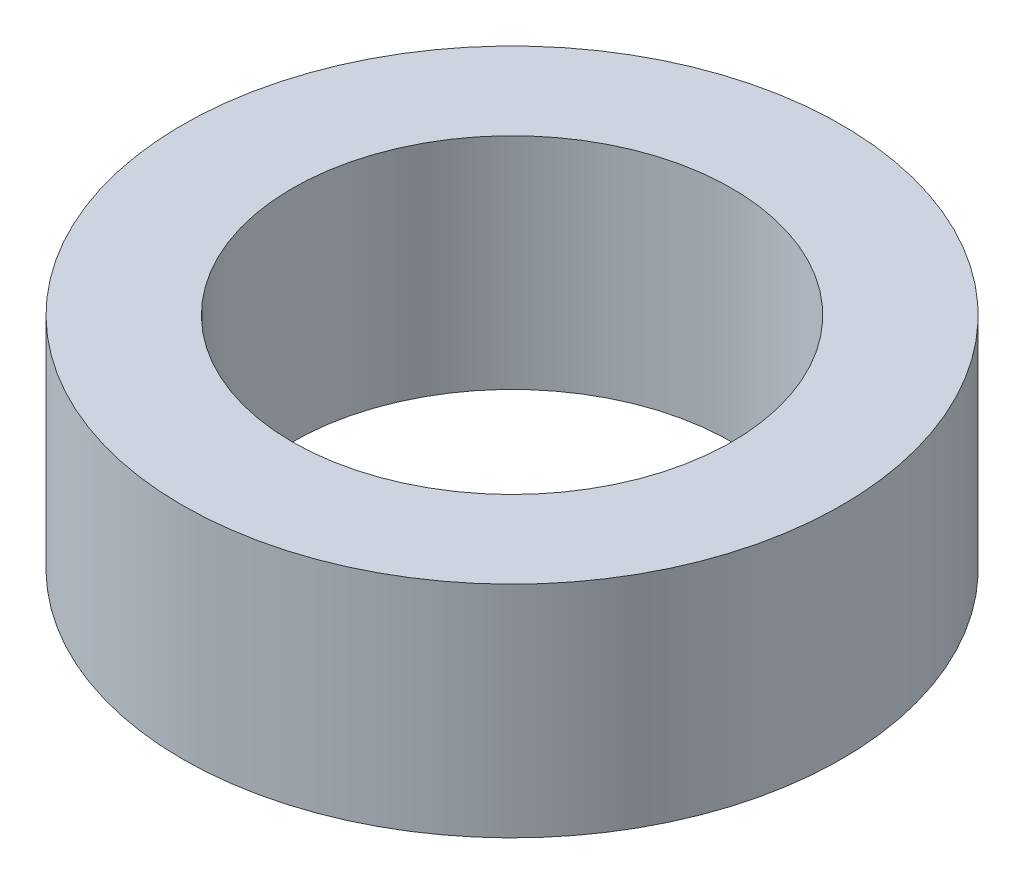
from build123d import *

# Parameters (mm, degrees)
SKETCH1_R           = 19.05
SKETCH1_R_2         = 12.7
BOSS_EXTRUDE2_DEPTH = 12.7


with BuildPart() as part:
    # Sketch1 → Boss-Extrude2 (new body)
    with BuildSketch(Plane(origin=(0, 0, 0), x_dir=(1, 0, 0), z_dir=(0, 1, 0))):
        with Locations(Location((0, 0, 0), (0, 0, 270))):
            Circle(SKETCH1_R)
        with Locations(Location((0, 0, 0), (0, 0, 270))):
            Circle(SKETCH1_R_2, mode=Mode.SUBTRACT)
    extrude(amount=BOSS_EXTRUDE2_DEPTH)

    # Sketch2 → Cut-Revolve1 (revolve, cut)
    with BuildSketch(Plane(origin=(0, 0, 0), x_dir=(0, 0, -1), z_dir=(1, 0, 0)), mode=Mode.PRIVATE) as cut_revolve1_sk:
        with BuildLine():
            Line((-18.985851973, 0), (-12.764148027, 0))
            ThreePointArc((-12.764148027, 0), (-15.875, 2.54), (-18.985851973, 0))
        make_face()
    revolve(cut_revolve1_sk.sketch.rotate(Axis((0, 0, 0), (0, 1, 0)), 180), axis=Axis((0, 0, 0), (0, 1, 0)), mode=Mode.SUBTRACT)


solid = part.part
